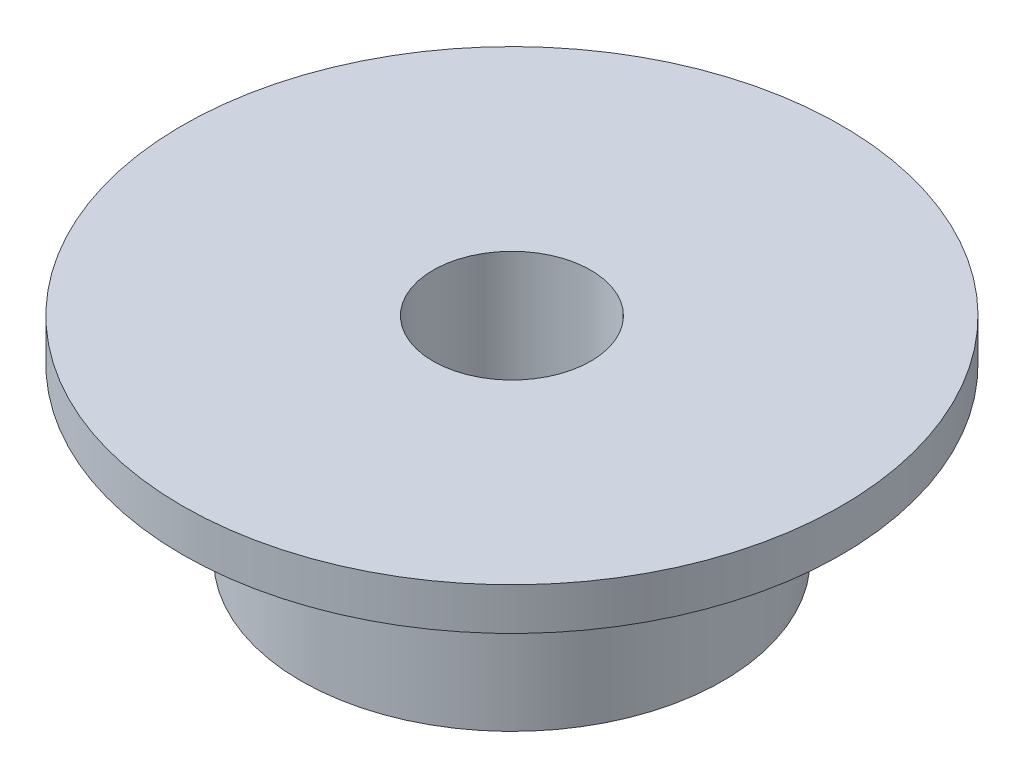
from build123d import *

# Parameters (mm, degrees)
SKETCH1_R           = 12.7
BOSS_EXTRUDE1_DEPTH = 10.16
SKETCH2_R           = 19.84375
SKETCH2_R_2         = 4.7498
BOSS_EXTRUDE2_DEPTH = 2.54
CUT_EXTRUDE1_START  = -12.7
SKETCH3_R           = 4.7498
CUT_EXTRUDE1_DEPTH  = 12.7


with BuildPart() as part:
    # Sketch1 → Boss-Extrude1 (new body)
    with BuildSketch(Plane(origin=(0, 0, 0), x_dir=(1, 0, 0), z_dir=(0, 1, 0))):
        with Locations(Location((-17.607350735, 10.410900498, 0), (0, 0, 270))):
            Circle(SKETCH1_R)
    extrude(amount=BOSS_EXTRUDE1_DEPTH)

    # Sketch2 → Boss-Extrude2 (add)
    with BuildSketch(Plane(origin=(0, 10.16, 0), x_dir=(1, 0, 0), z_dir=(0, 1, 0))):
        with Locations(Location((-17.607350735, 10.410900498, 0), (0, 0, 270))):
            Circle(SKETCH2_R)
        with Locations(Location((-17.607350735, 10.410900498, 0), (0, 0, 270))):
            Circle(SKETCH2_R_2, mode=Mode.SUBTRACT)
    extrude(amount=BOSS_EXTRUDE2_DEPTH)

    # Sketch3 → Cut-Extrude1 (cut)
    with BuildSketch(Plane(origin=(0, 10.16, 0), x_dir=(1, 0, 0), z_dir=(0, 1, 0)).offset(CUT_EXTRUDE1_START)):
        with Locations(Location((-17.607350735, 10.410900498, 0), (0, 0, 270))):
            Circle(SKETCH3_R)
    extrude(amount=CUT_EXTRUDE1_DEPTH, mode=Mode.SUBTRACT)


solid = part.part
